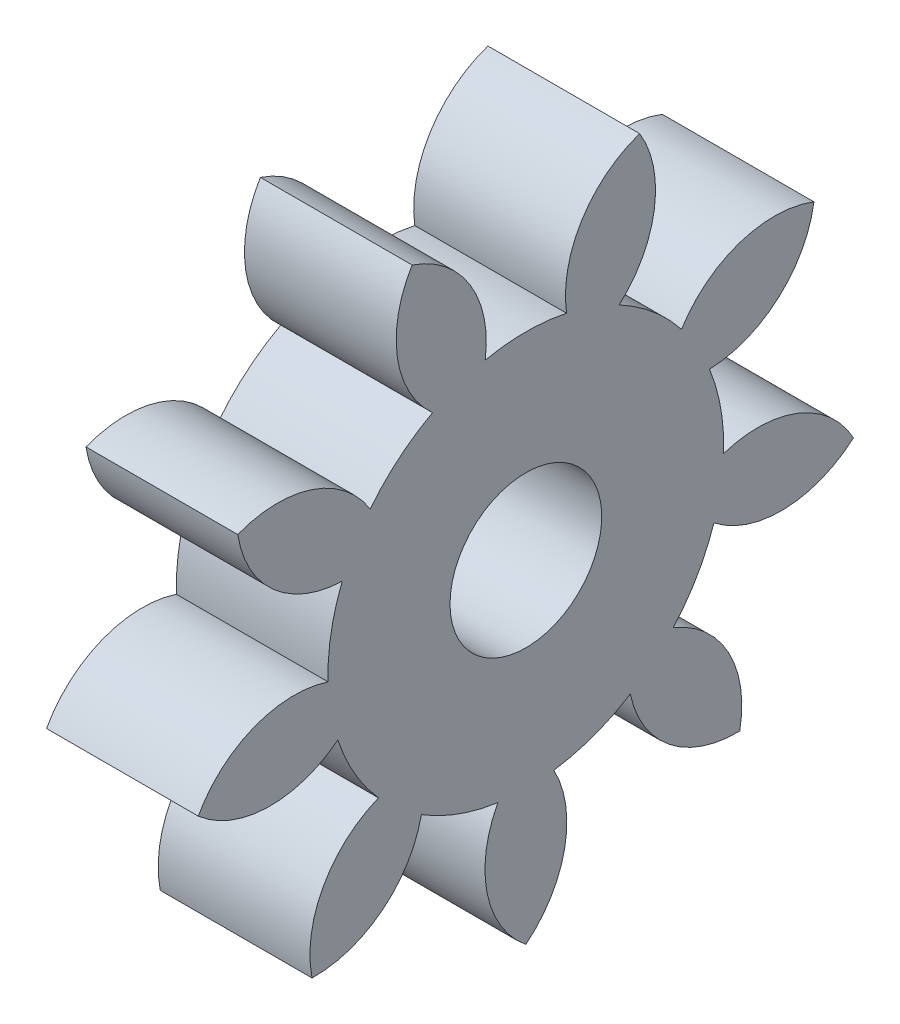
from build123d import *

# Parameters (mm, degrees)
BASPROSKE_W     = 3.175
BASPROSKE_H     = 6.985
TOOTHCUT_DEPTH  = 11.375985495
TEETHCUTS_COUNT = 9
BORSKE_R        = 1.5875
BORE_DEPTH      = 50.8000508


with BuildPart() as part:
    # BasProSke → Base-Revolve (revolve)
    with BuildSketch(Plane(origin=(0, 0, 0), x_dir=(1, 0, 0), z_dir=(0, 1, 0)), mode=Mode.PRIVATE) as base_revolve_sk:
        with Locations((1.5875, 3.4925)):
            Rectangle(BASPROSKE_W, BASPROSKE_H)
    revolve(base_revolve_sk.sketch.rotate(Axis((-10, 0, 0), (1, 0, 0)), 180), axis=Axis((-10, 0, 0), (1, 0, 0)))

    # TooCutSke → ToothCut (cut, through all)
    with BuildSketch(Plane(origin=(0, 0, 0), x_dir=(0, 0, -1), z_dir=(1, 0, 0))):
        with BuildLine():
            ThreePointArc((0.85090004, 4.051817513), (0, 4.1402), (-0.85090004, 4.051817513))
            ThreePointArc((-0.85090004, 4.051817513), (-1.187930048, 5.606894235), (-2.458065659, 6.565334826))
            ThreePointArc((-2.458065659, 6.565334826), (0, 7.0104), (2.458065659, 6.565334826))
            ThreePointArc((2.458065659, 6.565334826), (1.187930048, 5.606894235), (0.85090004, 4.051817513))
        make_face()
    toothcut = extrude(amount=TOOTHCUT_DEPTH, mode=Mode.SUBTRACT)

    # TeethCuts: ToothCut ×9 about axis
    teethcuts_axis = Axis((-10, 0, 0), (1, 0, 0))
    for i in range(1, TEETHCUTS_COUNT):
        add(toothcut.rotate(teethcuts_axis, i * 360 / TEETHCUTS_COUNT), mode=Mode.SUBTRACT)

    # BorSke → Bore (cut, symmetric)
    with BuildSketch(Plane(origin=(0, 0, 0), x_dir=(0, 0, -1), z_dir=(1, 0, 0))):
        with Locations(Location((0, 0, 0), (0, 0, 180))):
            Circle(BORSKE_R)
    extrude(amount=BORE_DEPTH, both=True, mode=Mode.SUBTRACT)


solid = part.part
